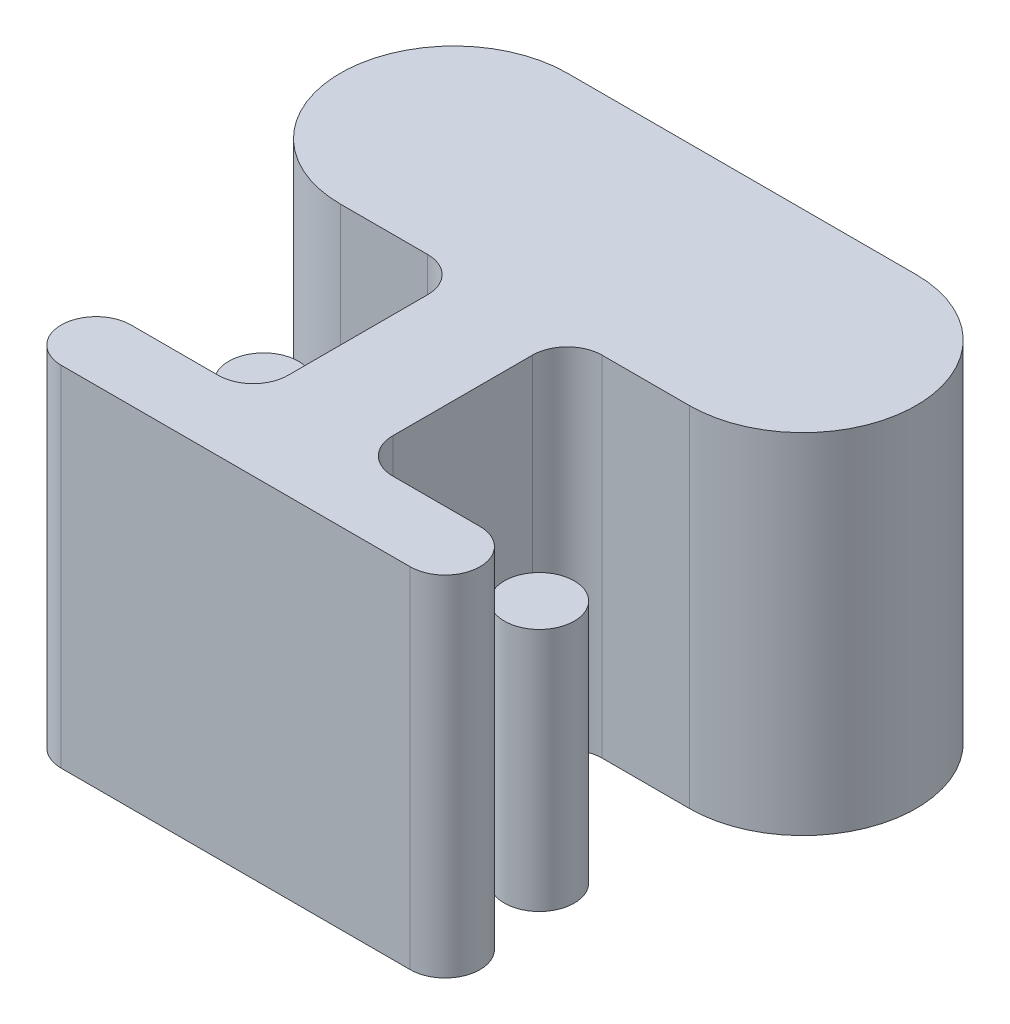
from build123d import *

# Parameters (mm, degrees)
BOSS_EXTRUDE1_DEPTH   = 1000
FILLET1_R             = 100
SKETCH2_R             = 100
BOSS_EXTRUDE2_DEPTH   = 700
BOSS_EXTRUDE2_2_DEPTH = 700


with BuildPart() as part:
    # Sketch1 → Boss-Extrude1 (new body)
    with BuildSketch(Plane(origin=(0, 0, 0), x_dir=(1, 0, 0), z_dir=(0, 1, 0))):
        with BuildLine():
            Line((150, -325), (500, -325))
            ThreePointArc((500, -325), (825, 0), (500, 325))
            Line((500, 325), (-500, 325))
            ThreePointArc((-500, 325), (-825, 0), (-500, -325))
            Line((-500, -325), (-150, -325))
            Line((-150, -325), (-150, -925))
            Line((-150, -925), (-500, -925))
            ThreePointArc((-500, -925), (-600, -1025), (-500, -1125))
            Line((-500, -1125), (500, -1125))
            ThreePointArc((500, -1125), (600, -1025), (500, -925))
            Line((500, -925), (150, -925))
            Line((150, -925), (150, -325))
        make_face()
    extrude(amount=BOSS_EXTRUDE1_DEPTH)

    # Fillet1
    fillet1_edges = [part.edges().sort_by_distance(p)[0] for p in [
        (150, 500, 325),
        (150, 500, 925),
        (-150, 500, 925),
        (-150, 500, 325),
    ]]
    fillet(fillet1_edges, radius=FILLET1_R)


with BuildPart() as body_2:
    # Sketch2 → Boss-Extrude2 (new body)
    with BuildSketch(Plane.XZ):
        with Locations(Location((470, 725, 0), (0, 0, 270))):
            Circle(SKETCH2_R)
    extrude(amount=-BOSS_EXTRUDE2_DEPTH)


with BuildPart() as body_3:
    # Sketch2 → Boss-Extrude2 2 (new body)
    with BuildSketch(Plane.XZ):
        with Locations(Location((-470, 575, 0), (0, 0, 270))):
            Circle(SKETCH2_R)
    extrude(amount=-BOSS_EXTRUDE2_2_DEPTH)


solid = Compound([part.part, body_2.part, body_3.part])
